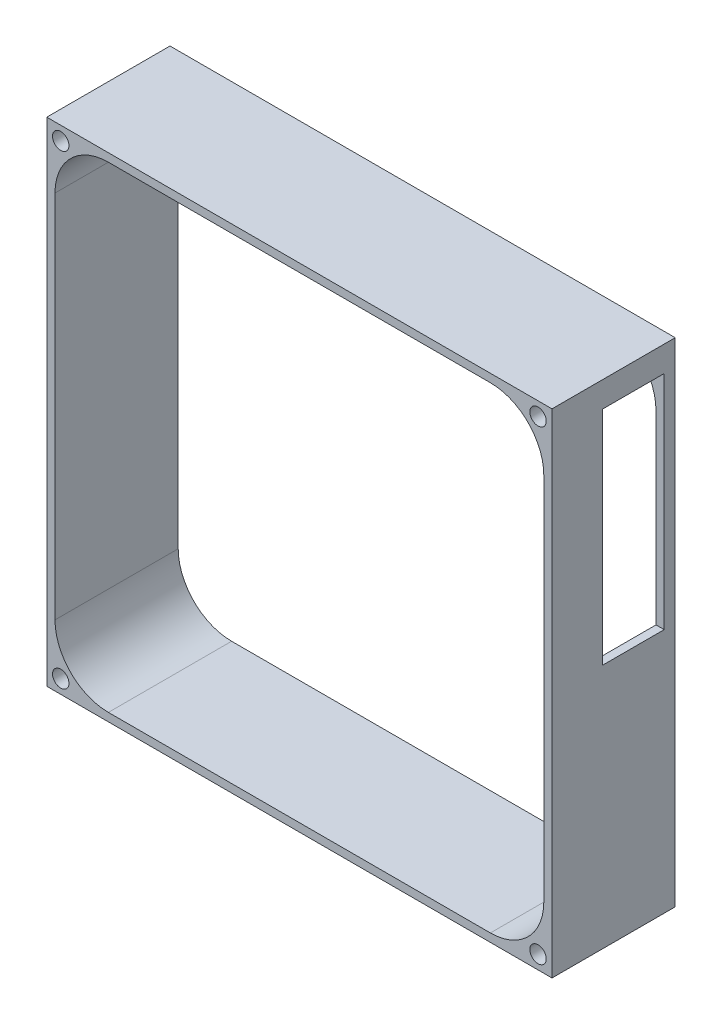
from build123d import *

# Parameters (mm, degrees)
SKETCH_1_W          = 123
SKETCH_1_H          = 120
SKETCH_1_R          = 2
EXTRUDE_1_DEPTH     = 30
SKETCH_2_W          = 15
SKETCH_2_H          = 54
CUT_EXTRUDE_1_DEPTH = 120


with BuildPart() as part:
    # 草图1 → 凸台-拉伸1 (new body)
    with BuildSketch(Plane.XY):
        with Locations((-25.906926203, 53.207805922)):
            Rectangle(SKETCH_1_W, SKETCH_1_H)
        with Locations((-84.008388051, 109.894431899)):
            Circle(SKETCH_1_R, mode=Mode.SUBTRACT)
        with Locations(Location((32.194535644, 109.894431899, 0), (0, 0, 180))):
            Circle(SKETCH_1_R, mode=Mode.SUBTRACT)
        with Locations((32.194535644, -3.478820055)):
            Circle(SKETCH_1_R, mode=Mode.SUBTRACT)
        with Locations(Location((-84.008388051, -3.478820055, 0), (0, 0, 180))):
            Circle(SKETCH_1_R, mode=Mode.SUBTRACT)
        with BuildLine():
            Line((-72.406926203, 111.207805922), (20.593073797, 111.207805922))
            ThreePointArc((20.593073797, 111.207805922), (29.785461952, 107.400194077), (33.593073797, 98.207805922))
            Line((33.593073797, 98.207805922), (33.593073797, 8.207805922))
            ThreePointArc((33.593073797, 8.207805922), (29.785461952, -0.984582233), (20.593073797, -4.792194078))
            Line((20.593073797, -4.792194078), (-72.406926203, -4.792194078))
            ThreePointArc((-72.406926203, -4.792194078), (-81.599314359, -0.984582233), (-85.406926203, 8.207805922))
            Line((-85.406926203, 8.207805922), (-85.406926203, 98.207805922))
            ThreePointArc((-85.406926203, 98.207805922), (-81.599314359, 107.400194077), (-72.406926203, 111.207805922))
        make_face(mode=Mode.SUBTRACT)
    extrude(amount=EXTRUDE_1_DEPTH)

    # 草图2 → 切除-拉伸1 (cut)
    with BuildSketch(Plane(origin=(35.593073797, 0, 0), x_dir=(0, 0, -1), z_dir=(1, 0, 0))):
        with Locations((-10.186283232, 79.999305489)):
            Rectangle(SKETCH_2_W, SKETCH_2_H)
    extrude(amount=-CUT_EXTRUDE_1_DEPTH, mode=Mode.SUBTRACT)


solid = part.part
